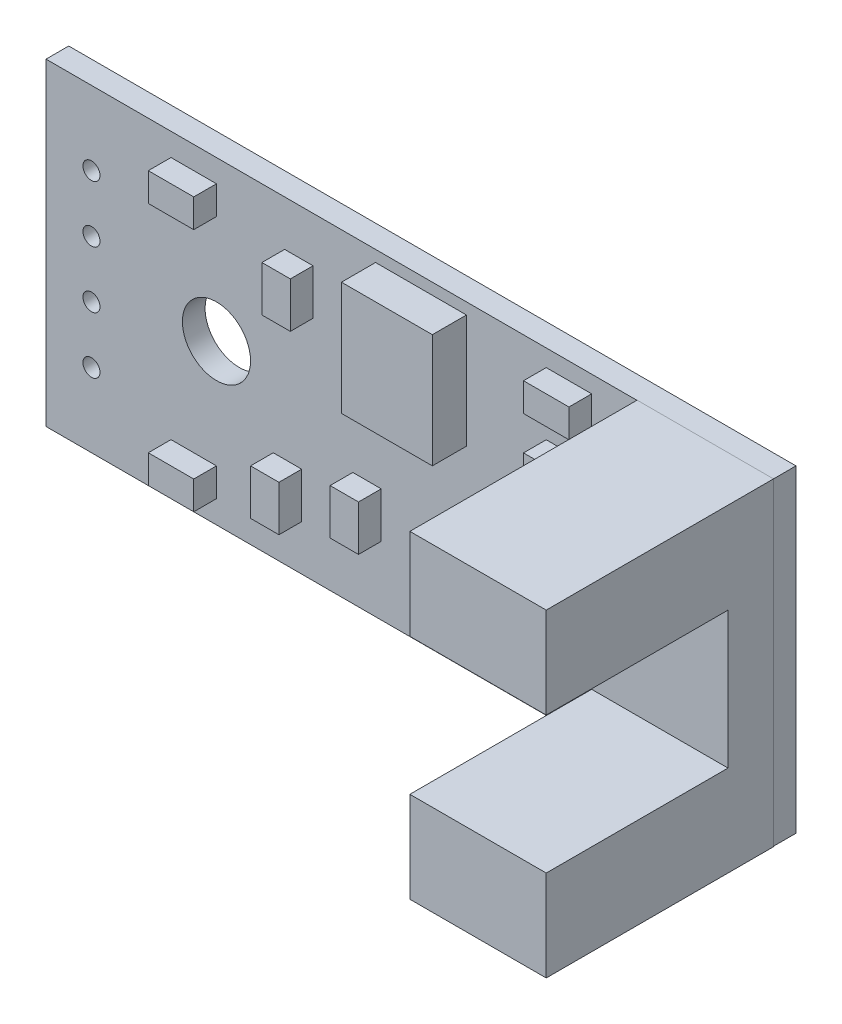
from build123d import *

# Parameters (mm, degrees)
ESQUISSE1_W        = 32
ESQUISSE1_H        = 14
ESQUISSE1_R        = 0.375
ESQUISSE1_R_2      = 1.5
BOSS_EXTRU_1_DEPTH = 1
ESQUISSE2_W        = 6
ESQUISSE2_H        = 14.02
BOSS_EXTRU_2_DEPTH = 2
ESQUISSE3_W        = 6
ESQUISSE3_H        = 4
BOSS_EXTRU_3_DEPTH = 8
ESQUISSE4_W        = 4
ESQUISSE4_H        = 5
BOSS_EXTRU_4_DEPTH = 1.5
ESQUISSE5_W        = 1.25
ESQUISSE5_H        = 2
ESQUISSE5_W_2      = 2
ESQUISSE5_H_2      = 1.25
BOSS_EXTRU_5_DEPTH = 1


with BuildPart() as part:
    # Esquisse1 → Boss.-Extru.1 (new body)
    with BuildSketch(Plane.XY):
        with Locations((16, 7)):
            Rectangle(ESQUISSE1_W, ESQUISSE1_H)
        with Locations((2, 8.25)):
            Circle(ESQUISSE1_R, mode=Mode.SUBTRACT)
        with Locations((2, 10.75)):
            Circle(ESQUISSE1_R, mode=Mode.SUBTRACT)
        with Locations((2, 5.75)):
            Circle(ESQUISSE1_R, mode=Mode.SUBTRACT)
        with Locations((2, 3.25)):
            Circle(ESQUISSE1_R, mode=Mode.SUBTRACT)
        with Locations((7.5, 7)):
            Circle(ESQUISSE1_R_2, mode=Mode.SUBTRACT)
    extrude(amount=BOSS_EXTRU_1_DEPTH)

    # Esquisse2 → Boss.-Extru.2 (add)
    with BuildSketch(Plane.XY.offset(1)):
        with Locations((29.01, 7)):
            Rectangle(ESQUISSE2_W, ESQUISSE2_H)
    extrude(amount=BOSS_EXTRU_2_DEPTH)

    # Esquisse3 → Boss.-Extru.3 (add)
    with BuildSketch(Plane.XY.offset(3)):
        with Locations((29.01, 12.01)):
            Rectangle(ESQUISSE3_W, ESQUISSE3_H)
        with Locations((29.01, 1.99)):
            Rectangle(ESQUISSE3_W, ESQUISSE3_H)
    extrude(amount=BOSS_EXTRU_3_DEPTH)

    # Esquisse4 → Boss.-Extru.4 (add)
    with BuildSketch(Plane.XY.offset(1)):
        with Locations((16.5, 11)):
            Rectangle(ESQUISSE4_W, ESQUISSE4_H)
    extrude(amount=BOSS_EXTRU_4_DEPTH)

    # Esquisse5 → Boss.-Extru.5 (add)
    with BuildSketch(Plane.XY.offset(1)):
        with Locations((11.125, 11)):
            Rectangle(ESQUISSE5_W, ESQUISSE5_H)
        with Locations((10.625, 3)):
            Rectangle(ESQUISSE5_W, ESQUISSE5_H)
        with Locations((14.125, 4)):
            Rectangle(ESQUISSE5_W, ESQUISSE5_H)
        with Locations((17.875, 4)):
            Rectangle(ESQUISSE5_W, ESQUISSE5_H)
        with Locations((23.01, 12.625)):
            Rectangle(ESQUISSE5_W_2, ESQUISSE5_H_2)
        with Locations((23.01, 9.875)):
            Rectangle(ESQUISSE5_W_2, ESQUISSE5_H_2)
        with Locations((23.01, 7.125)):
            Rectangle(ESQUISSE5_W_2, ESQUISSE5_H_2)
        with Locations((23.01, 4.375)):
            Rectangle(ESQUISSE5_W_2, ESQUISSE5_H_2)
        with Locations((23.01, 1.625)):
            Rectangle(ESQUISSE5_W_2, ESQUISSE5_H_2)
        with Locations((6.5, 12.375)):
            Rectangle(ESQUISSE5_W_2, ESQUISSE5_H_2)
        with Locations((6.5, 1.625)):
            Rectangle(ESQUISSE5_W_2, ESQUISSE5_H_2)
    extrude(amount=BOSS_EXTRU_5_DEPTH)


solid = part.part
